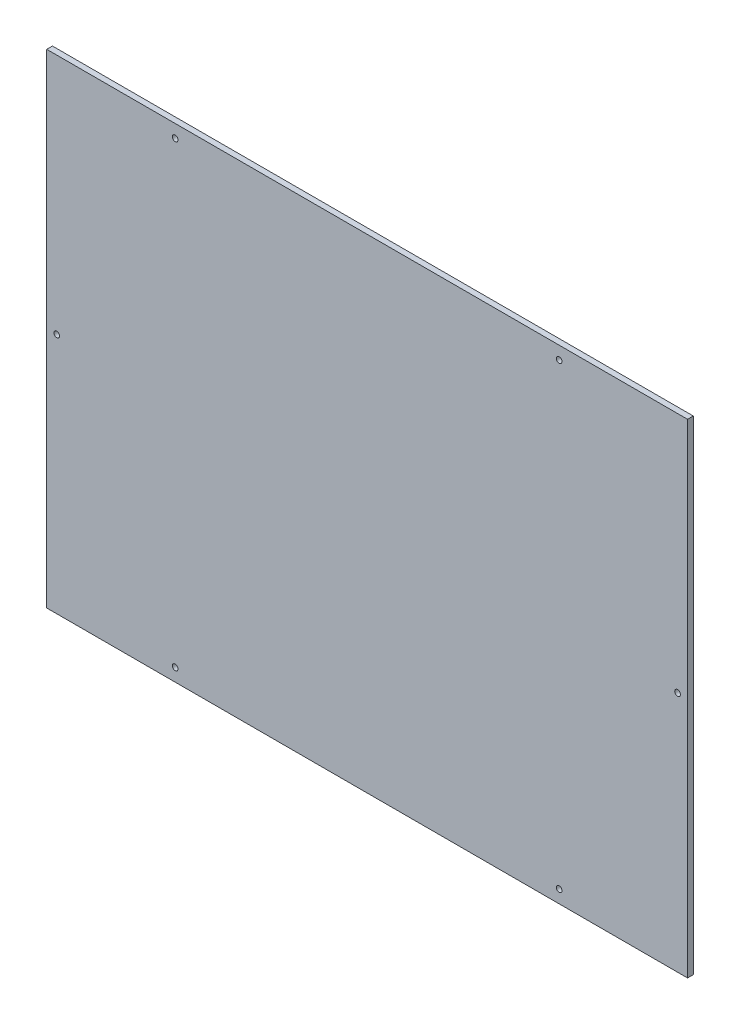
from build123d import *

# Parameters (mm, degrees)
SCHIZZO1_W                   = 449
SCHIZZO1_H                   = 339
SCHIZZO1_R                   = 2
ESTRUSIONE_ESTRUSIONE1_DEPTH = 4


with BuildPart() as part:
    # Schizzo1 → Estrusione-Estrusione1 (new body)
    with BuildSketch(Plane.XY):
        with Locations((-224.5, 169.5)):
            Rectangle(SCHIZZO1_W, SCHIZZO1_H)
        with Locations(Location((-90, 330, 0), (0, 0, 180))):
            Circle(SCHIZZO1_R, mode=Mode.SUBTRACT)
        with Locations((-7, 169.5)):
            Circle(SCHIZZO1_R, mode=Mode.SUBTRACT)
        with Locations((-359, 330)):
            Circle(SCHIZZO1_R, mode=Mode.SUBTRACT)
        with Locations(Location((-442, 169.5, 0), (0, 0, 180))):
            Circle(SCHIZZO1_R, mode=Mode.SUBTRACT)
        with Locations(Location((-359, 9, 0), (0, 0, 180))):
            Circle(SCHIZZO1_R, mode=Mode.SUBTRACT)
        with Locations((-90, 9)):
            Circle(SCHIZZO1_R, mode=Mode.SUBTRACT)
    extrude(amount=ESTRUSIONE_ESTRUSIONE1_DEPTH)


solid = part.part
